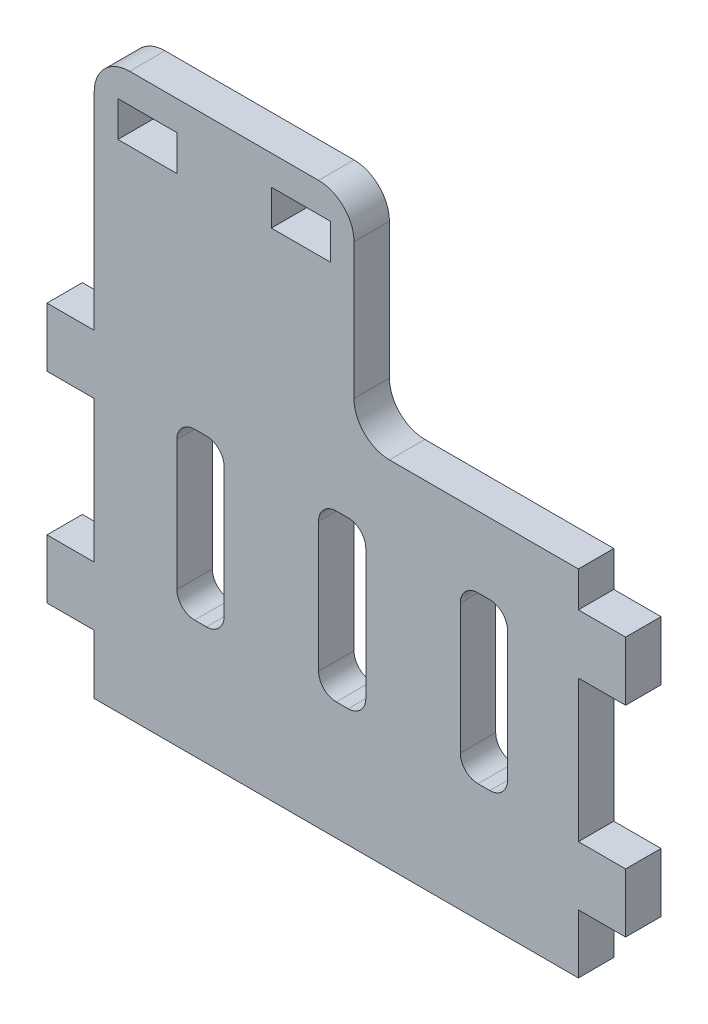
from build123d import *

# Parameters (mm, degrees)
SKETCH_1_W          = 41
SKETCH_1_H          = 30
EXTRUDE_1_DEPTH     = 3
SKETCH_2_W          = 4
SKETCH_2_H          = 5
EXTRUDE_2_DEPTH     = 3
SKETCH_3_W          = 22
SKETCH_3_H          = 17.5
EXTRUDE_3_DEPTH     = 3
SKETCH_4_W          = 5
SKETCH_4_H          = 3
CUT_EXTRUDE_1_DEPTH = 10
FILLET_1_R          = 3
SKETCH_5_W          = 4
SKETCH_5_H          = 14
CUT_EXTRUDE_2_DEPTH = 10
FILLET_2_R          = 1.5


with BuildPart() as part:
    # 草图1 → 凸台-拉伸1 (new body)
    with BuildSketch(Plane.XY):
        Rectangle(SKETCH_1_W, SKETCH_1_H)
    extrude(amount=EXTRUDE_1_DEPTH)

    # 草图2 → 凸台-拉伸2 (add)
    with BuildSketch(Plane.XY.offset(3)):
        with Locations((22.5, -7.5)):
            Rectangle(SKETCH_2_W, SKETCH_2_H)
        with Locations((22.5, 9.5)):
            Rectangle(SKETCH_2_W, SKETCH_2_H)
        with Locations((-22.5, -7.5)):
            Rectangle(SKETCH_2_W, SKETCH_2_H)
        with Locations((-22.5, 9.5)):
            Rectangle(SKETCH_2_W, SKETCH_2_H)
    extrude(amount=-EXTRUDE_2_DEPTH)

    # 草图3 → 凸台-拉伸3 (add)
    with BuildSketch(Plane.XY.offset(3)):
        with Locations((-9.5, 23.75)):
            Rectangle(SKETCH_3_W, SKETCH_3_H)
    extrude(amount=-EXTRUDE_3_DEPTH)

    # 草图4 → 切除-拉伸1 (cut)
    with BuildSketch(Plane.XY.offset(3)):
        with Locations((-16, 28.5)):
            Rectangle(SKETCH_4_W, SKETCH_4_H)
        with Locations((-3, 28.5)):
            Rectangle(SKETCH_4_W, SKETCH_4_H)
    extrude(amount=-CUT_EXTRUDE_1_DEPTH, mode=Mode.SUBTRACT)

    # 圆角1
    fillet_1_edges = [part.edges().sort_by_distance(p)[0] for p in [
        (1.5, 15, 1.5),
        (1.5, 32.5, 1.5),
        (-20.5, 32.5, 1.5),
    ]]
    fillet(fillet_1_edges, radius=FILLET_1_R)

    # 草图5 → 切除-拉伸2 (cut)
    with BuildSketch(Plane.XY.offset(3)):
        with Locations((-11.5, 2)):
            Rectangle(SKETCH_5_W, SKETCH_5_H)
        with Locations((0.5, 2)):
            Rectangle(SKETCH_5_W, SKETCH_5_H)
        with Locations((12.5, 2)):
            Rectangle(SKETCH_5_W, SKETCH_5_H)
    extrude(amount=-CUT_EXTRUDE_2_DEPTH, mode=Mode.SUBTRACT)

    # 圆角2
    fillet_2_edges = [part.edges().sort_by_distance(p)[0] for p in [
        (-13.5, -5, 1.5),
        (-13.5, 9, 1.5),
        (-9.5, 9, 1.5),
        (-9.5, -5, 1.5),
        (-1.5, 9, 1.5),
        (2.5, 9, 1.5),
        (2.5, -5, 1.5),
        (-1.5, -5, 1.5),
        (10.5, 9, 1.5),
        (14.5, 9, 1.5),
        (14.5, -5, 1.5),
        (10.5, -5, 1.5),
    ]]
    fillet(fillet_2_edges, radius=FILLET_2_R)


solid = part.part
